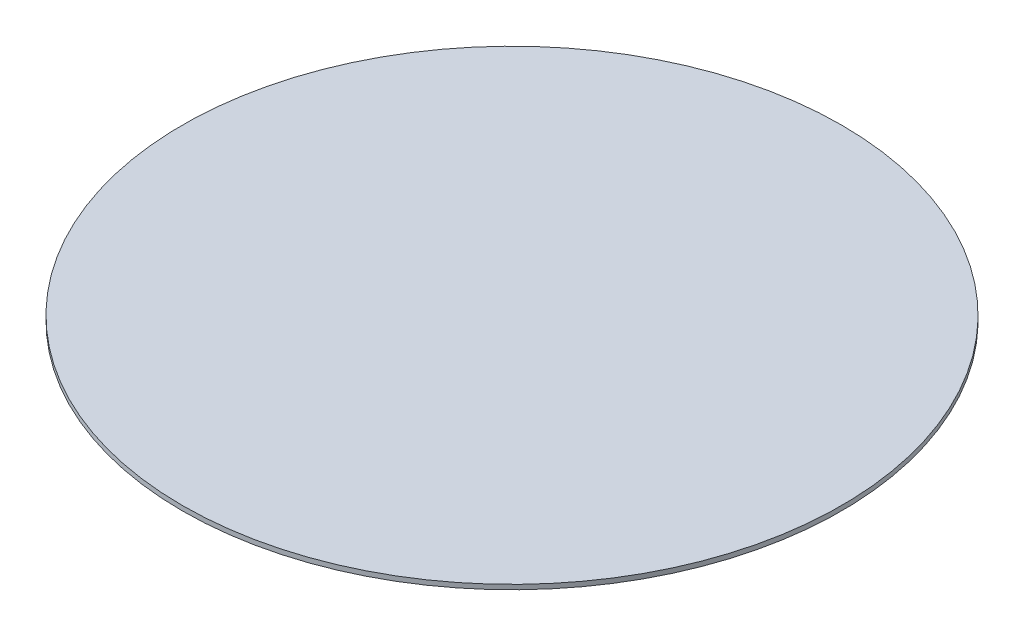
from build123d import *

# Parameters (mm, degrees)
SKETCH1_R           = 35
BOSS_EXTRUDE1_DEPTH = 0.5


with BuildPart() as part:
    # Sketch1 → Boss-Extrude1 (new body)
    with BuildSketch(Plane(origin=(0, 0, 0), x_dir=(1, 0, 0), z_dir=(0, 1, 0))):
        with Locations(Location((0, 0, 0), (0, 0, 270))):
            Circle(SKETCH1_R)
    extrude(amount=BOSS_EXTRUDE1_DEPTH)


solid = part.part
